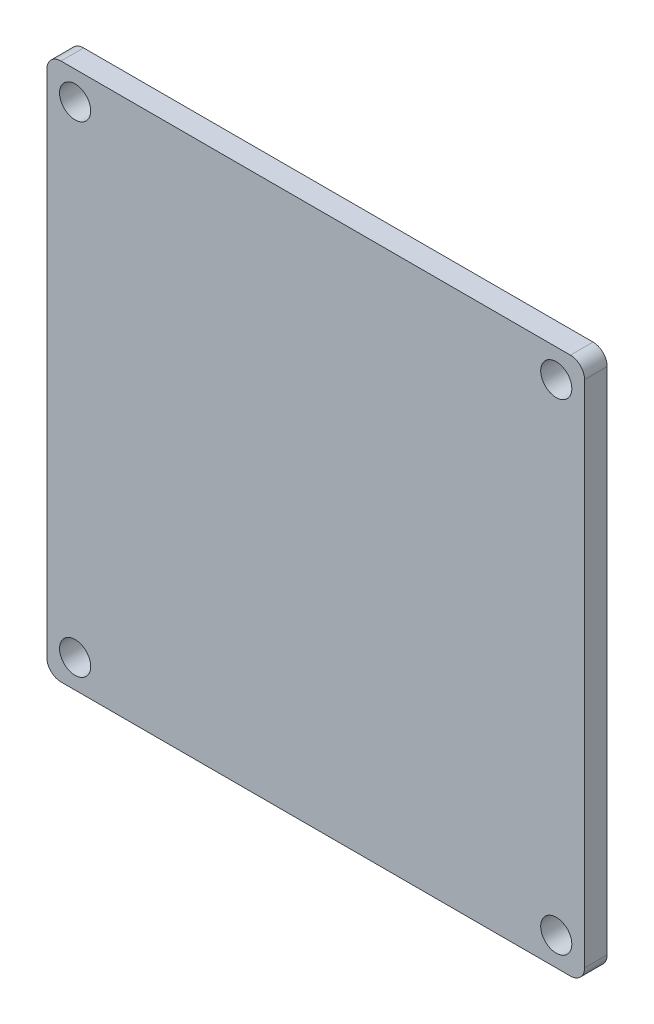
from build123d import *

# Parameters (mm, degrees)
SKETCH_1_W          = 38
SKETCH_1_H          = 38
EXTRUDE_1_DEPTH     = 1.6
SKETCH_2_R          = 1.1
CUT_EXTRUDE_1_DEPTH = 27.917652201
FILLET_1_R          = 1


with BuildPart() as part:
    # 스케치1 → 보스-돌출1 (new body)
    with BuildSketch(Plane.XY):
        Rectangle(SKETCH_1_W, SKETCH_1_H)
    extrude(amount=EXTRUDE_1_DEPTH)

    # 스케치2 → 컷-돌출1 (cut, through all)
    with BuildSketch(Plane.XY.offset(1.6)):
        with Locations((-17, 17)):
            Circle(SKETCH_2_R)
        with Locations((17, -17)):
            Circle(SKETCH_2_R)
        with Locations((17, 17)):
            Circle(SKETCH_2_R)
        with Locations((-17, -17)):
            Circle(SKETCH_2_R)
    extrude(amount=-CUT_EXTRUDE_1_DEPTH, mode=Mode.SUBTRACT)

    # 필렛1
    fillet_1_edges = [part.edges().sort_by_distance(p)[0] for p in [
        (-19, 19, 0.8),
        (19, 19, 0.8),
        (19, -19, 0.8),
        (-19, -19, 0.8),
    ]]
    fillet(fillet_1_edges, radius=FILLET_1_R)


solid = part.part
